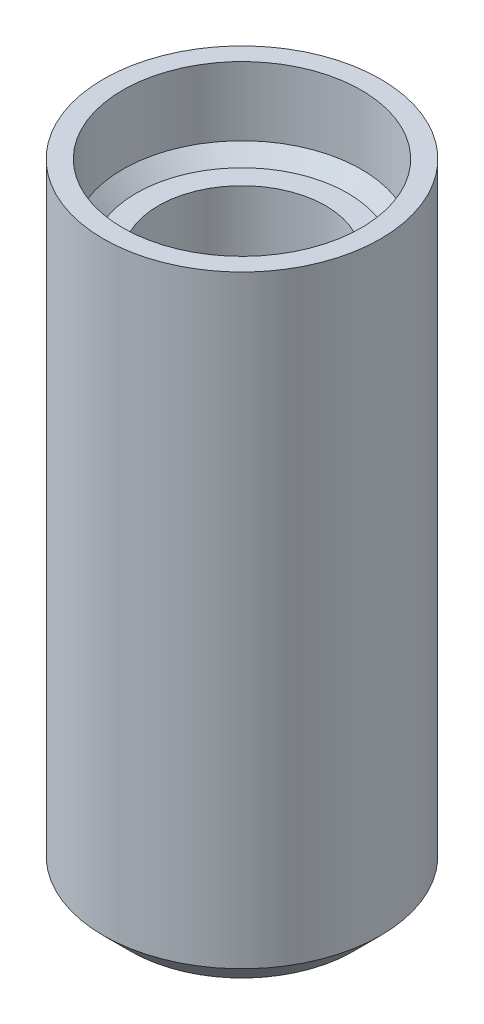
from build123d import *

# Parameters (mm, degrees)
SKETCH1_R           = 5.05
BOSS_EXTRUDE1_DEPTH = 20
SKETCH2_R           = 5.05
BOSS_EXTRUDE2_DEPTH = 2
SKETCH4_R           = 5.05
SKETCH4_R_2         = 4.35
BOSS_EXTRUDE3_DEPTH = 3
CHAMFER1_SIZE       = 1
CHAMFER2_SIZE       = 0.5
CUT_EXTRUDE1_DEPTH  = 0.4
BOSS_EXTRUDE4_DEPTH = 0.4


with BuildPart() as part:
    # Sketch1 → Boss-Extrude1 (new body)
    with BuildSketch(Plane(origin=(0, 0, 0), x_dir=(1, 0, 0), z_dir=(0, 1, 0))):
        Circle(SKETCH1_R)
        with BuildLine():
            Line((2.565151068, -1.65), (-2.565151068, -1.65))
            ThreePointArc((-2.565151068, -1.65), (0, 3.05), (2.565151068, -1.65))
        make_face(mode=Mode.SUBTRACT)
    extrude(amount=BOSS_EXTRUDE1_DEPTH)

    # Sketch2 → Boss-Extrude2 (add)
    with BuildSketch(Plane.XZ):
        Circle(SKETCH2_R)
    extrude(amount=-BOSS_EXTRUDE2_DEPTH)

    # Sketch4 → Boss-Extrude3 (add)
    with BuildSketch(Plane(origin=(0, 20, 0), x_dir=(1, 0, 0), z_dir=(0, 1, 0))):
        Circle(SKETCH4_R)
        Circle(SKETCH4_R_2, mode=Mode.SUBTRACT)
    extrude(amount=BOSS_EXTRUDE3_DEPTH)

    # Chamfer1
    chamfer1_edges = [part.edges().sort_by_distance(p)[0] for p in [
        (-5.05, 0, 0),
    ]]
    chamfer(chamfer1_edges, length=CHAMFER1_SIZE)

    # Chamfer2
    chamfer2_edges = [part.edges().sort_by_distance(p)[0] for p in [
        (-4.35, 20, 0),
    ]]
    chamfer(chamfer2_edges, length=CHAMFER2_SIZE)

    # Sketch5 → Cut-Extrude1 (cut)
    with BuildSketch(Plane.XZ):
        with BuildLine():
            add(Edge.make_bspline(
                [(1.439948587, -1.653012389), (1.439876699, -1.683045128), (1.43974458, -1.738240911), (1.431271471, -1.813705895), (1.420527775, -1.875466606), (1.403574072, -1.923288418), (1.383622282, -1.959101708), (1.360105213, -1.983267515), (1.333129744, -1.998183394), (1.313801842, -1.999386809), (1.303953443, -2)],
                knots=[0, 0, 0, 0, 1.769380938, 3.251863504, 4.473793643, 5.456147252, 6.231459106, 6.87077347, 7.424610359, 8, 8, 8, 8], degree=3))
            Line((1.303953443, -2), (-1.115960155, -2))
            add(Edge.make_bspline(
                [(-1.115960155, -2), (-1.124764856, -1.999235199), (-1.143000862, -1.997651168), (-1.169069324, -1.98355213), (-1.191525204, -1.958680582), (-1.211674261, -1.923370629), (-1.22844035, -1.875430661), (-1.2396129, -1.81377917), (-1.2461065, -1.738146636), (-1.247303601, -1.683026326), (-1.247955442, -1.653012389)],
                knots=[0, 0, 0, 0, 0.521835169, 1.080807807, 1.712179375, 2.494680724, 3.486143732, 4.719404872, 6.213660719, 8, 8, 8, 8], degree=3))
            add(Edge.make_bspline(
                [(-1.247955442, -1.653012389), (-1.247564606, -1.622348678), (-1.246849977, -1.56628126), (-1.242082904, -1.489472136), (-1.229908593, -1.427530805), (-1.214570878, -1.378346332), (-1.19448558, -1.341252685), (-1.171381331, -1.314540094), (-1.143493064, -1.299098496), (-1.123793171, -1.297048409), (-1.113960226, -1.296025135)],
                knots=[0, 0, 0, 0, 1.773338699, 3.242481697, 4.440534656, 5.415572, 6.2091949, 6.863837362, 7.432899261, 8, 8, 8, 8], degree=3))
            Line((-1.113960226, -1.296025135), (-0.287989717, -1.296025135))
            Line((-0.287989717, -1.296025135), (-0.287989717, 1.455876608))
            Line((-0.287989717, 1.455876608), (-0.993964511, 1.071890319))
            add(Edge.make_bspline(
                [(-0.993964511, 1.071890319), (-1.017440507, 1.061445685), (-1.058655219, 1.043108974), (-1.115600787, 1.024261243), (-1.164016876, 1.022727864), (-1.204048063, 1.044740206), (-1.227168973, 1.090535397), (-1.241056947, 1.154646882), (-1.245930838, 1.243521995), (-1.247219803, 1.311235138), (-1.247955442, 1.349880393)],
                knots=[0, 0, 0, 0, 1.16110972, 2.038456742, 2.701448753, 3.288176025, 3.990880841, 4.937165991, 6.251978929, 8, 8, 8, 8], degree=3))
            add(Edge.make_bspline(
                [(-1.247955442, 1.349880393), (-1.247653425, 1.374880402), (-1.247109683, 1.419889746), (-1.245945241, 1.481671813), (-1.240636397, 1.532510166), (-1.22932079, 1.574897869), (-1.214108207, 1.610487858), (-1.190963524, 1.639477582), (-1.161196377, 1.665121533), (-1.138457223, 1.681091287), (-1.125959798, 1.689868254)],
                knots=[0, 0, 0, 0, 1.56313437, 2.814225196, 3.86369772, 4.748352527, 5.550351806, 6.263187403, 7.045448883, 8, 8, 8, 8], degree=3))
            Line((-1.125959798, 1.689868254), (-0.183993431, 2.306846225))
            add(Edge.make_bspline(
                [(-0.183993431, 2.306846225), (-0.177863774, 2.311559679), (-0.16490946, 2.321521017), (-0.139222649, 2.329492175), (-0.109092066, 2.338056382), (-0.070433284, 2.34348131), (-0.022153707, 2.34904437), (0.039686671, 2.349651098), (0.117302801, 2.352623049), (0.17498744, 2.352122396), (0.206992609, 2.351844618)],
                knots=[0, 0, 0, 0, 0.462162572, 0.976726718, 1.600024173, 2.352504238, 3.321320859, 4.526493399, 6.072794308, 8, 8, 8, 8], degree=3))
            add(Edge.make_bspline(
                [(0.206992609, 2.351844618), (0.246335885, 2.351808308), (0.316381456, 2.351743662), (0.410069056, 2.347873639), (0.481820359, 2.341824657), (0.534201311, 2.331725803), (0.572123093, 2.320729809), (0.59477989, 2.300462138), (0.607217242, 2.276119035), (0.607713437, 2.258338867), (0.607978292, 2.248848296)],
                knots=[0, 0, 0, 0, 2.095956985, 3.731578029, 4.998773625, 5.921870021, 6.585026704, 7.062945429, 7.499825718, 8, 8, 8, 8], degree=3))
            Line((0.607978292, 2.248848296), (0.607978292, -1.296025135))
            Line((0.607978292, -1.296025135), (1.306953335, -1.296025135))
            add(Edge.make_bspline(
                [(1.306953335, -1.296025135), (1.316786669, -1.297048343), (1.336487341, -1.299098296), (1.364369456, -1.314540952), (1.387502528, -1.341248585), (1.407443488, -1.378367057), (1.42348129, -1.427311655), (1.431911749, -1.489804249), (1.43957322, -1.566161665), (1.43981592, -1.622316445), (1.439948587, -1.653012389)],
                knots=[0, 0, 0, 0, 0.567469369, 1.136901174, 1.79196917, 2.586107946, 3.56177909, 4.753767401, 6.225508585, 8, 8, 8, 8], degree=3))
        make_face()
    extrude(amount=-CUT_EXTRUDE1_DEPTH, mode=Mode.SUBTRACT)


with BuildPart() as body_2:
    # Sketch5<2> → Boss-Extrude4 (new body)
    with BuildSketch(Plane.XZ):
        with BuildLine():
            add(Edge.make_bspline(
                [(1.439948587, -1.653012389), (1.439876699, -1.683045128), (1.43974458, -1.738240911), (1.431271471, -1.813705895), (1.420527775, -1.875466606), (1.403574072, -1.923288418), (1.383622282, -1.959101708), (1.360105213, -1.983267515), (1.333129744, -1.998183394), (1.313801842, -1.999386809), (1.303953443, -2)],
                knots=[0, 0, 0, 0, 1.769380938, 3.251863504, 4.473793643, 5.456147252, 6.231459106, 6.87077347, 7.424610359, 8, 8, 8, 8], degree=3))
            Line((1.303953443, -2), (-1.115960155, -2))
            add(Edge.make_bspline(
                [(-1.115960155, -2), (-1.124764856, -1.999235199), (-1.143000862, -1.997651168), (-1.169069324, -1.98355213), (-1.191525204, -1.958680582), (-1.211674261, -1.923370629), (-1.22844035, -1.875430661), (-1.2396129, -1.81377917), (-1.2461065, -1.738146636), (-1.247303601, -1.683026326), (-1.247955442, -1.653012389)],
                knots=[0, 0, 0, 0, 0.521835169, 1.080807807, 1.712179375, 2.494680724, 3.486143732, 4.719404872, 6.213660719, 8, 8, 8, 8], degree=3))
            add(Edge.make_bspline(
                [(-1.247955442, -1.653012389), (-1.247564606, -1.622348678), (-1.246849977, -1.56628126), (-1.242082904, -1.489472136), (-1.229908593, -1.427530805), (-1.214570878, -1.378346332), (-1.19448558, -1.341252685), (-1.171381331, -1.314540094), (-1.143493064, -1.299098496), (-1.123793171, -1.297048409), (-1.113960226, -1.296025135)],
                knots=[0, 0, 0, 0, 1.773338699, 3.242481697, 4.440534656, 5.415572, 6.2091949, 6.863837362, 7.432899261, 8, 8, 8, 8], degree=3))
            Line((-1.113960226, -1.296025135), (-0.287989717, -1.296025135))
            Line((-0.287989717, -1.296025135), (-0.287989717, 1.455876608))
            Line((-0.287989717, 1.455876608), (-0.993964511, 1.071890319))
            add(Edge.make_bspline(
                [(-0.993964511, 1.071890319), (-1.017440507, 1.061445685), (-1.058655219, 1.043108974), (-1.115600787, 1.024261243), (-1.164016876, 1.022727864), (-1.204048063, 1.044740206), (-1.227168973, 1.090535397), (-1.241056947, 1.154646882), (-1.245930838, 1.243521995), (-1.247219803, 1.311235138), (-1.247955442, 1.349880393)],
                knots=[0, 0, 0, 0, 1.16110972, 2.038456742, 2.701448753, 3.288176025, 3.990880841, 4.937165991, 6.251978929, 8, 8, 8, 8], degree=3))
            add(Edge.make_bspline(
                [(-1.247955442, 1.349880393), (-1.247653425, 1.374880402), (-1.247109683, 1.419889746), (-1.245945241, 1.481671813), (-1.240636397, 1.532510166), (-1.22932079, 1.574897869), (-1.214108207, 1.610487858), (-1.190963524, 1.639477582), (-1.161196377, 1.665121533), (-1.138457223, 1.681091287), (-1.125959798, 1.689868254)],
                knots=[0, 0, 0, 0, 1.56313437, 2.814225196, 3.86369772, 4.748352527, 5.550351806, 6.263187403, 7.045448883, 8, 8, 8, 8], degree=3))
            Line((-1.125959798, 1.689868254), (-0.183993431, 2.306846225))
            add(Edge.make_bspline(
                [(-0.183993431, 2.306846225), (-0.177863774, 2.311559679), (-0.16490946, 2.321521017), (-0.139222649, 2.329492175), (-0.109092066, 2.338056382), (-0.070433284, 2.34348131), (-0.022153707, 2.34904437), (0.039686671, 2.349651098), (0.117302801, 2.352623049), (0.17498744, 2.352122396), (0.206992609, 2.351844618)],
                knots=[0, 0, 0, 0, 0.462162572, 0.976726718, 1.600024173, 2.352504238, 3.321320859, 4.526493399, 6.072794308, 8, 8, 8, 8], degree=3))
            add(Edge.make_bspline(
                [(0.206992609, 2.351844618), (0.246335885, 2.351808308), (0.316381456, 2.351743662), (0.410069056, 2.347873639), (0.481820359, 2.341824657), (0.534201311, 2.331725803), (0.572123093, 2.320729809), (0.59477989, 2.300462138), (0.607217242, 2.276119035), (0.607713437, 2.258338867), (0.607978292, 2.248848296)],
                knots=[0, 0, 0, 0, 2.095956985, 3.731578029, 4.998773625, 5.921870021, 6.585026704, 7.062945429, 7.499825718, 8, 8, 8, 8], degree=3))
            Line((0.607978292, 2.248848296), (0.607978292, -1.296025135))
            Line((0.607978292, -1.296025135), (1.306953335, -1.296025135))
            add(Edge.make_bspline(
                [(1.306953335, -1.296025135), (1.316786669, -1.297048343), (1.336487341, -1.299098296), (1.364369456, -1.314540952), (1.387502528, -1.341248585), (1.407443488, -1.378367057), (1.42348129, -1.427311655), (1.431911749, -1.489804249), (1.43957322, -1.566161665), (1.43981592, -1.622316445), (1.439948587, -1.653012389)],
                knots=[0, 0, 0, 0, 0.567469369, 1.136901174, 1.79196917, 2.586107946, 3.56177909, 4.753767401, 6.225508585, 8, 8, 8, 8], degree=3))
        make_face()
    extrude(amount=-BOSS_EXTRUDE4_DEPTH)


solid = Compound([part.part, body_2.part])
